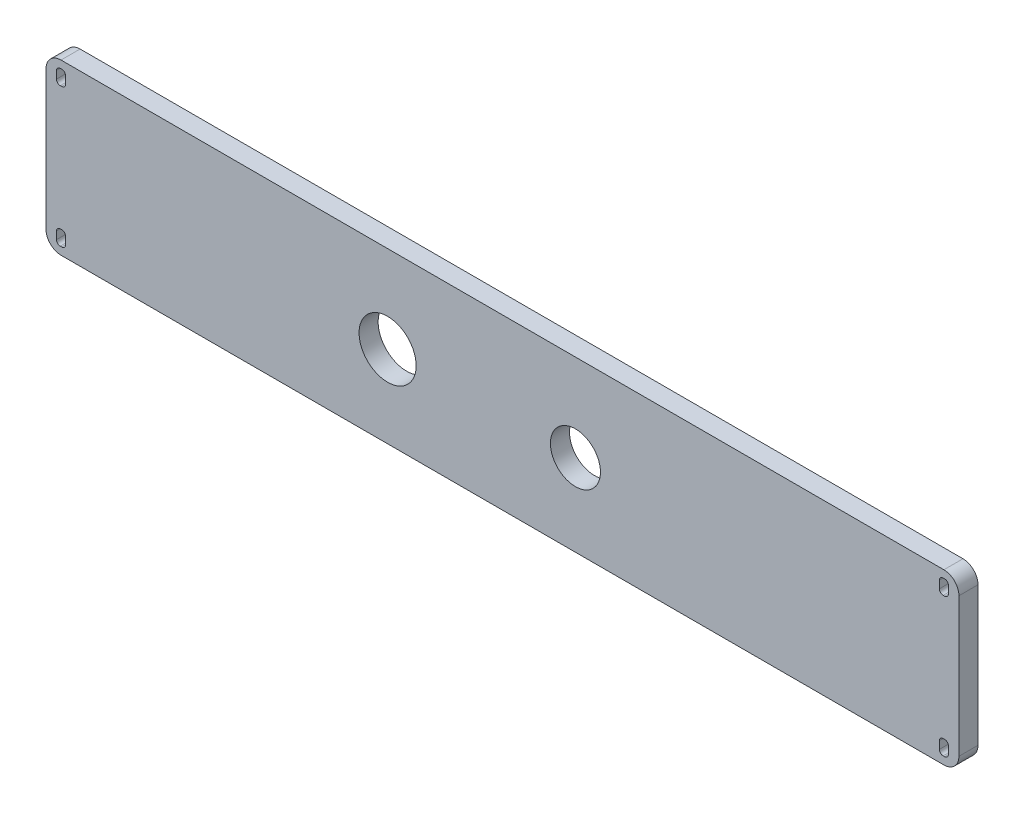
from build123d import *

# Parameters (mm, degrees)
SKETCH1_W           = 607.568
SKETCH1_H           = 112.522
SKETCH1_R           = 16.65
SKETCH1_R_2         = 19
BOSS_EXTRUDE1_DEPTH = 12.7
FILLET1_R           = 10


with BuildPart() as part:
    # Sketch1 → Boss-Extrude1 (new body)
    with BuildSketch(Plane.XY):
        with Locations((40.068414536, 75.801223419)):
            Rectangle(SKETCH1_W, SKETCH1_H)
        with Locations((88.632564672, 74.018682095)):
            Circle(SKETCH1_R, mode=Mode.SUBTRACT)
        with Locations((-36.367435328, 74.018682095)):
            Circle(SKETCH1_R_2, mode=Mode.SUBTRACT)
        with BuildLine():
            Line((334.352414536, 24.540223419), (333.352414536, 24.540223419))
            ThreePointArc((333.352414536, 24.540223419), (331.584647583, 25.272456466), (330.852414536, 27.040223419))
            Line((330.852414536, 27.040223419), (330.852414536, 32.040223419))
            ThreePointArc((330.852414536, 32.040223419), (331.584647583, 33.807990372), (333.352414536, 34.540223419))
            Line((333.352414536, 34.540223419), (334.352414536, 34.540223419))
            ThreePointArc((334.352414536, 34.540223419), (336.120181489, 33.807990372), (336.852414536, 32.040223419))
            Line((336.852414536, 32.040223419), (336.852414536, 27.040223419))
            ThreePointArc((336.852414536, 27.040223419), (336.120181489, 25.272456466), (334.352414536, 24.540223419))
        make_face(mode=Mode.SUBTRACT)
        with BuildLine():
            Line((-253.217585464, 24.540223419), (-254.217585464, 24.540223419))
            ThreePointArc((-254.217585464, 24.540223419), (-255.985352417, 25.272456466), (-256.717585464, 27.040223419))
            Line((-256.717585464, 27.040223419), (-256.717585464, 32.040223419))
            ThreePointArc((-256.717585464, 32.040223419), (-255.985352417, 33.807990372), (-254.217585464, 34.540223419))
            Line((-254.217585464, 34.540223419), (-253.217585464, 34.540223419))
            ThreePointArc((-253.217585464, 34.540223419), (-251.449818511, 33.807990372), (-250.717585464, 32.040223419))
            Line((-250.717585464, 32.040223419), (-250.717585464, 27.040223419))
            ThreePointArc((-250.717585464, 27.040223419), (-251.449818511, 25.272456466), (-253.217585464, 24.540223419))
        make_face(mode=Mode.SUBTRACT)
        with BuildLine():
            Line((-253.217585464, 117.060223419), (-254.217585464, 117.060223419))
            ThreePointArc((-254.217585464, 117.060223419), (-255.985352417, 117.792456466), (-256.717585464, 119.560223419))
            Line((-256.717585464, 119.560223419), (-256.717585464, 124.560223419))
            ThreePointArc((-256.717585464, 124.560223419), (-255.985352417, 126.327990372), (-254.217585464, 127.060223419))
            Line((-254.217585464, 127.060223419), (-253.217585464, 127.060223419))
            ThreePointArc((-253.217585464, 127.060223419), (-251.449818511, 126.327990372), (-250.717585464, 124.560223419))
            Line((-250.717585464, 124.560223419), (-250.717585464, 119.560223419))
            ThreePointArc((-250.717585464, 119.560223419), (-251.449818511, 117.792456466), (-253.217585464, 117.060223419))
        make_face(mode=Mode.SUBTRACT)
        with BuildLine():
            Line((334.352414536, 117.060223419), (333.352414536, 117.060223419))
            ThreePointArc((333.352414536, 117.060223419), (331.584647583, 117.792456466), (330.852414536, 119.560223419))
            Line((330.852414536, 119.560223419), (330.852414536, 124.560223419))
            ThreePointArc((330.852414536, 124.560223419), (331.584647583, 126.327990372), (333.352414536, 127.060223419))
            Line((333.352414536, 127.060223419), (334.352414536, 127.060223419))
            ThreePointArc((334.352414536, 127.060223419), (336.120181489, 126.327990372), (336.852414536, 124.560223419))
            Line((336.852414536, 124.560223419), (336.852414536, 119.560223419))
            ThreePointArc((336.852414536, 119.560223419), (336.120181489, 117.792456466), (334.352414536, 117.060223419))
        make_face(mode=Mode.SUBTRACT)
    extrude(amount=BOSS_EXTRUDE1_DEPTH)

    # Fillet1
    fillet1_edges = [part.edges().sort_by_distance(p)[0] for p in [
        (-263.715585464, 132.062223419, 6.35),
        (-263.715585464, 19.540223419, 6.35),
        (343.852414536, 19.540223419, 6.35),
        (343.852414536, 132.062223419, 6.35),
    ]]
    fillet(fillet1_edges, radius=FILLET1_R)


solid = part.part
